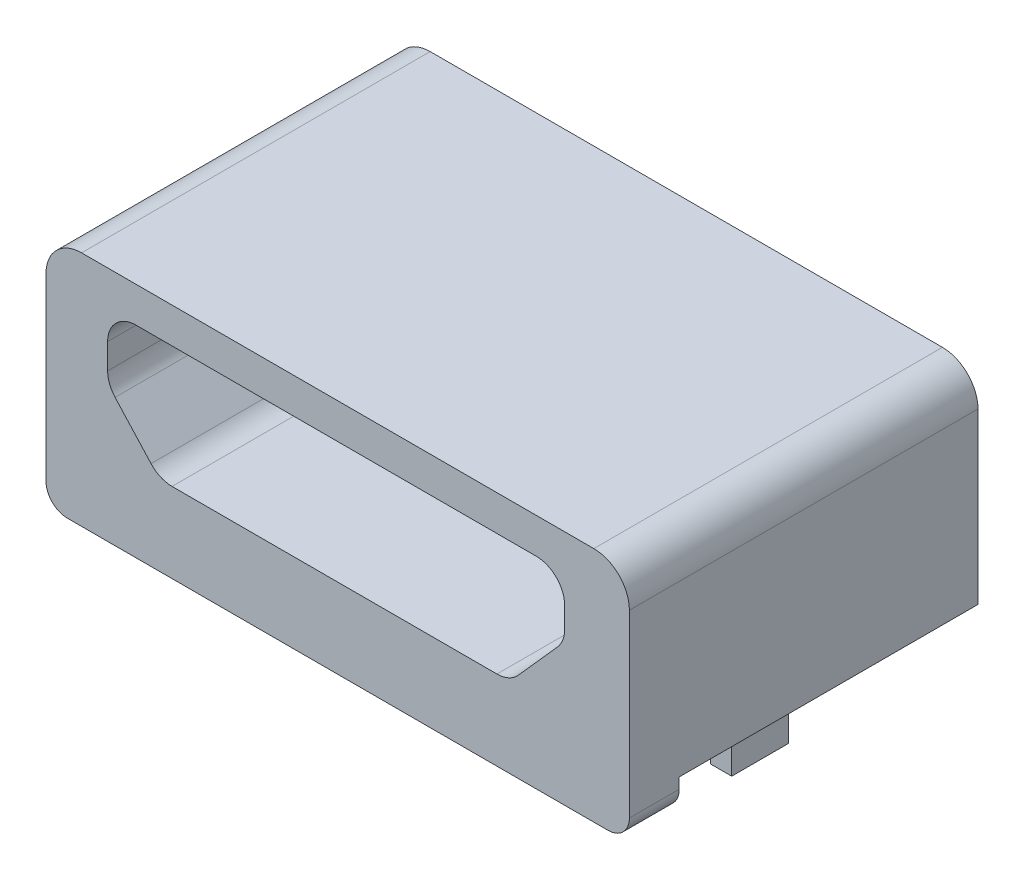
from build123d import *

# Parameters (mm, degrees)
SKETCH1_W           = 8.2
SKETCH1_H           = 2.88
BOSS_EXTRUDE1_DEPTH = 4.2
SKETCH2_W           = 8.2
SKETCH2_H           = 3.33
BOSS_EXTRUDE2_DEPTH = 0.7
FILLET1_R           = 0.5
FILLET2_R           = 0.3
CUT_EXTRUDE1_DEPTH  = 3
SKETCH4_W           = 0.3
SKETCH4_H           = 0.8
BOSS_EXTRUDE3_DEPTH = 0.7


with BuildPart() as part:
    # Sketch1 → Boss-Extrude1 (new body)
    with BuildSketch(Plane.XY):
        with Locations((4.1, 1.44)):
            Rectangle(SKETCH1_W, SKETCH1_H)
    extrude(amount=BOSS_EXTRUDE1_DEPTH)

    # Sketch2 → Boss-Extrude2 (add)
    with BuildSketch(Plane.XY.offset(4.2)):
        with Locations((4.1, 1.215)):
            Rectangle(SKETCH2_W, SKETCH2_H)
    extrude(amount=BOSS_EXTRUDE2_DEPTH)

    # Fillet1
    fillet1_edges = [part.edges().sort_by_distance(p)[0] for p in [
        (0, 2.88, 2.45),
        (8.2, 2.88, 2.45),
    ]]
    fillet(fillet1_edges, radius=FILLET1_R)

    # Fillet2
    fillet2_edges = [part.edges().sort_by_distance(p)[0] for p in [
        (8.2, -0.45, 4.55),
        (0, -0.45, 4.55),
    ]]
    fillet(fillet2_edges, radius=FILLET2_R)

    # Sketch3 → Cut-Extrude1 (cut)
    with BuildSketch(Plane.XY.offset(4.9)):
        with BuildLine():
            Line((1.266074212, 2.382685956), (6.890517388, 2.382685956))
            ThreePointArc((6.890517388, 2.382685956), (7.173360101, 2.265528668), (7.290517388, 1.982685956))
            Line((7.290517388, 1.982685956), (7.290517388, 1.692784748))
            ThreePointArc((7.290517388, 1.692784748), (7.264361959, 1.550516562), (7.189316204, 1.426853803))
            Line((7.189316204, 1.426853803), (6.63716933, 0.806464056))
            ThreePointArc((6.63716933, 0.806464056), (6.502119746, 0.707448171), (6.338370514, 0.672395002))
            Line((6.338370514, 0.672395002), (1.771767033, 0.672395002))
            ThreePointArc((1.771767033, 0.672395002), (1.610340732, 0.706414744), (1.476372836, 0.802687256))
            Line((1.476372836, 0.802687256), (0.970680014, 1.356541299))
            ThreePointArc((0.970680014, 1.356541299), (0.893141457, 1.481607555), (0.866074212, 1.626249045))
            Line((0.866074212, 1.626249045), (0.866074212, 1.982685956))
            ThreePointArc((0.866074212, 1.982685956), (0.983231499, 2.265528668), (1.266074212, 2.382685956))
        make_face()
    extrude(amount=-CUT_EXTRUDE1_DEPTH, mode=Mode.SUBTRACT)

    # Sketch4 → Boss-Extrude3 (add)
    with BuildSketch(Plane.XZ):
        with Locations((0.49, 2.722)):
            Rectangle(SKETCH4_W, SKETCH4_H)
        with Locations((7.710000038, 2.722)):
            Rectangle(SKETCH4_W, SKETCH4_H)
    extrude(amount=BOSS_EXTRUDE3_DEPTH)


solid = part.part
